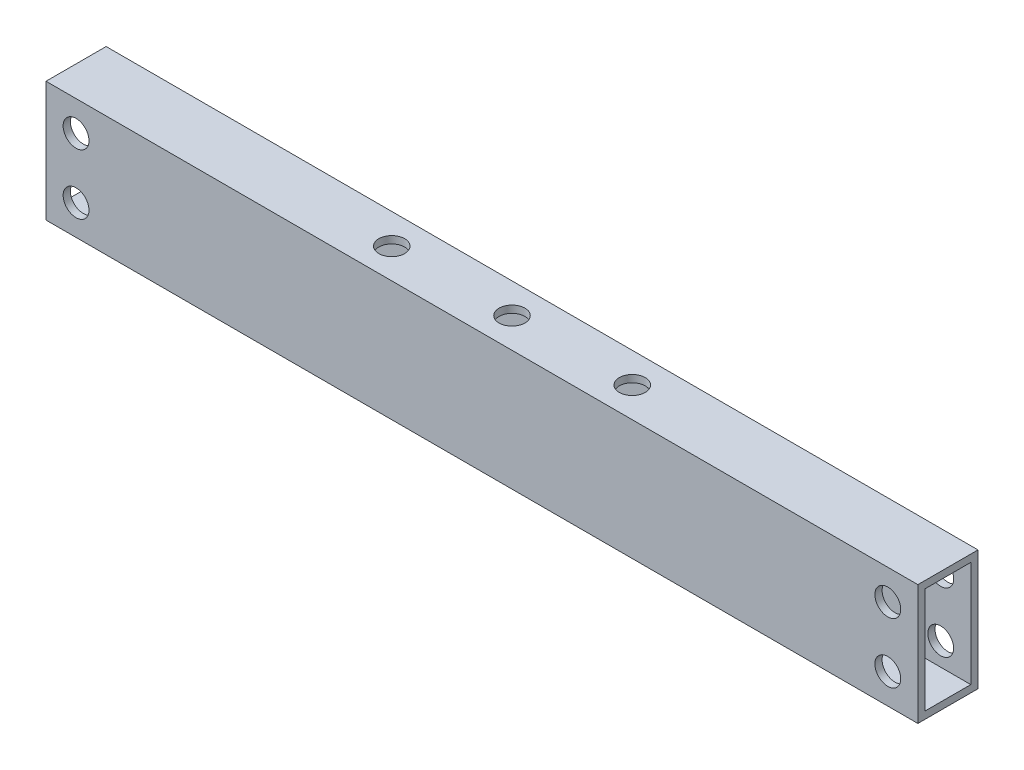
from build123d import *

# Parameters (mm, degrees)
SKETCH_1_W          = 10
SKETCH_1_H          = 20
SKETCH_1_W_2        = 7.6
SKETCH_1_H_2        = 17.6
EXTRUDE_1_DEPTH     = 145
SKETCH_3_R          = 2.15
CUT_EXTRUDE_1_DEPTH = 147.458185159
SKETCH_4_R          = 2.15
CUT_EXTRUDE_2_DEPTH = 146.688022843


with BuildPart() as part:
    # ｽｹｯﾁ1 → 押し出し-薄板1 (new body)
    with BuildSketch(Plane(origin=(0, 0, 0), x_dir=(0, 0, -1), z_dir=(1, 0, 0))):
        Rectangle(SKETCH_1_W, SKETCH_1_H)
        Rectangle(SKETCH_1_W_2, SKETCH_1_H_2, mode=Mode.SUBTRACT)
    extrude(amount=EXTRUDE_1_DEPTH)

    # ｽｹｯﾁ3 → ｶｯﾄ - 押し出し1 (cut, through all)
    with BuildSketch(Plane(origin=(0, 10, 0), x_dir=(1, 0, 0), z_dir=(0, 1, 0))):
        with Locations(Location((92.5, 0, 0), (0, 0, 270))):
            Circle(SKETCH_3_R)
        with Locations(Location((52.5, 0, 0), (0, 0, 270))):
            Circle(SKETCH_3_R)
        with Locations(Location((72.5, 0, 0), (0, 0, 270))):
            Circle(SKETCH_3_R)
    extrude(amount=-CUT_EXTRUDE_1_DEPTH, mode=Mode.SUBTRACT)

    # ｽｹｯﾁ4 → ｶｯﾄ - 押し出し2 (cut, through all)
    with BuildSketch(Plane.XY.offset(5)):
        with Locations((140, 5)):
            Circle(SKETCH_4_R)
        with Locations(Location((140, -5, 0), (0, 0, 90))):
            Circle(SKETCH_4_R)
        with Locations(Location((5, 5, 0), (0, 0, 90))):
            Circle(SKETCH_4_R)
        with Locations((5, -5)):
            Circle(SKETCH_4_R)
    extrude(amount=-CUT_EXTRUDE_2_DEPTH, mode=Mode.SUBTRACT)


solid = part.part
